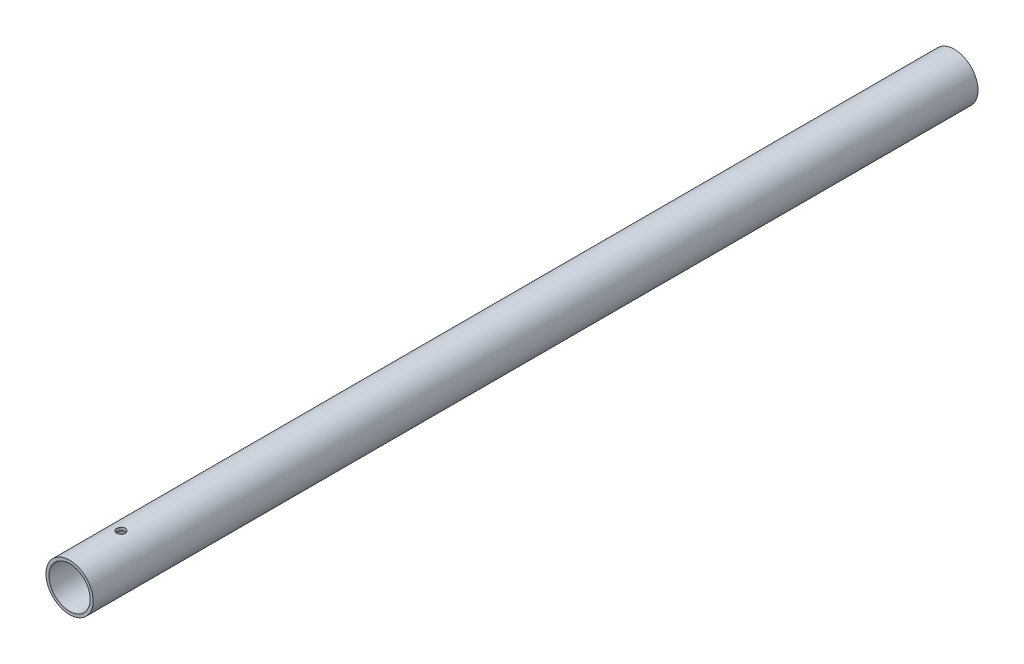
from build123d import *

# Parameters (mm, degrees)
SKETCH1_R              = 8
SKETCH1_R_2            = 7
BOSS_EXTRUDE1_DEPTH    = 300
M2_5_CLEARANCE_HOLE1_D = 2.9


with BuildPart() as part:
    # Sketch1 → Boss-Extrude1 (new body)
    with BuildSketch(Plane.XY):
        Circle(SKETCH1_R)
        Circle(SKETCH1_R_2, mode=Mode.SUBTRACT)
    extrude(amount=BOSS_EXTRUDE1_DEPTH)

    # M2.5 Clearance Hole1 (through all)
    with Locations(Plane(origin=(0, 8, 0), x_dir=(1, 0, 0), z_dir=(0, 1, 0))):
        with Locations((0, -282.6)):
            Hole(M2_5_CLEARANCE_HOLE1_D / 2)


solid = part.part
